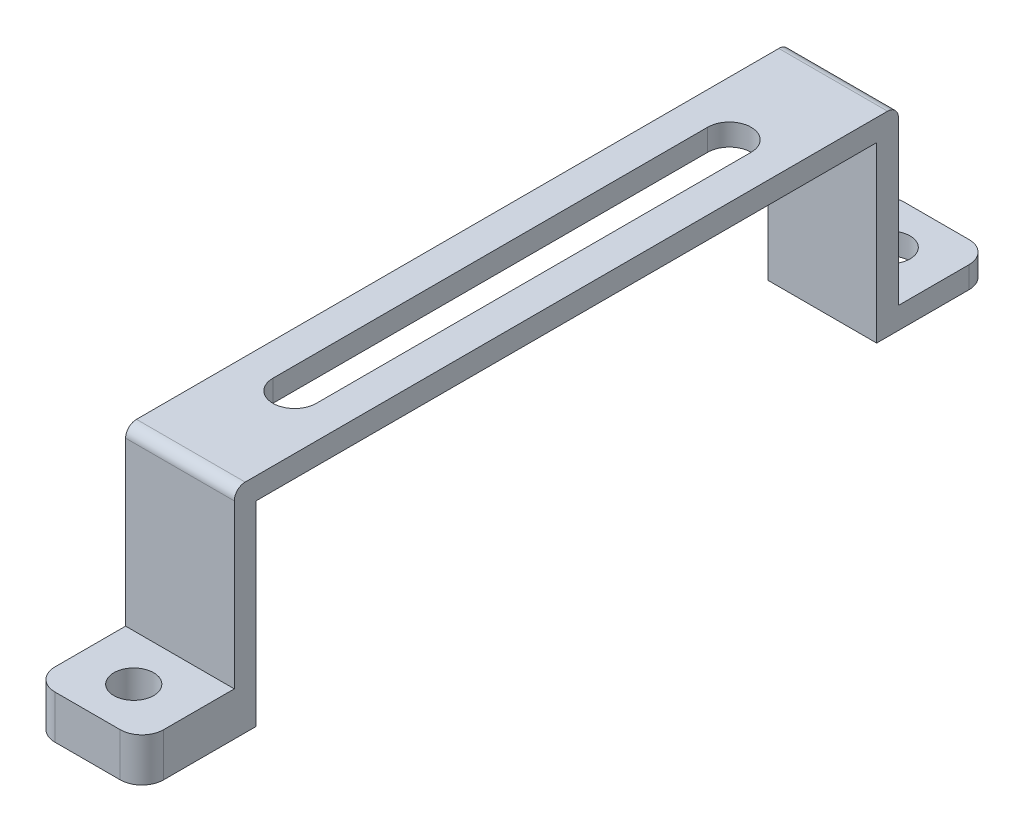
from build123d import *

# Parameters (mm, degrees)
SKETCH4_W                 = 10
SKETCH4_H                 = 57
BOSS_EXTRUDE3_DEPTH       = 2
SKETCH5_W                 = 10
SKETCH5_H                 = 2
BOSS_EXTRUDE4_DEPTH       = 2.05
SKETCH6_W                 = 10
SKETCH6_H                 = 2
BOSS_EXTRUDE5_DEPTH       = 15.9766
SKETCH7_W                 = 10
SKETCH7_H                 = 4
BOSS_EXTRUDE6_DEPTH       = 8.5
SKETCH8_W                 = 10
SKETCH8_H                 = 2
BOSS_EXTRUDE7_DEPTH       = 2.05
SKETCH9_W                 = 10
SKETCH9_H                 = 2
BOSS_EXTRUDE8_DEPTH       = 15.9766
SKETCH10_W                = 10
SKETCH10_H                = 2
BOSS_EXTRUDE9_DEPTH       = 8.5
F_6_CLEARANCE_HOLE1_D     = 3.6576
F_6_CLEARANCE_HOLE1_DEPTH = 7.62
F_6_CLEARANCE_HOLE1_TIP   = 1.0988539
FILLET2_R                 = 1
FILLET3_R                 = 2
SKETCH16_W                = 10
SKETCH16_H                = 2
BOSS_EXTRUDE10_DEPTH      = 2


with BuildPart() as part:
    # Sketch4 → Boss-Extrude3 (new body)
    with BuildSketch(Plane(origin=(0, 0, 0), x_dir=(1, 0, 0), z_dir=(0, 1, 0))):
        with Locations((11.706300269, -28.497829615)):
            Rectangle(SKETCH4_W, SKETCH4_H)
        with BuildLine():
            Line((13.706300269, -8.497829615), (13.706300269, -48.497829615))
            ThreePointArc((13.706300269, -48.497829615), (11.706300269, -50.497829615), (9.706300269, -48.497829615))
            Line((9.706300269, -48.497829615), (9.706300269, -8.497829615))
            ThreePointArc((9.706300269, -8.497829615), (11.706300269, -6.497829615), (13.706300269, -8.497829615))
        make_face(mode=Mode.SUBTRACT)
    extrude(amount=BOSS_EXTRUDE3_DEPTH)

    # Sketch5 → Boss-Extrude4 (add)
    with BuildSketch(Plane.XY.offset(56.997829615)):
        with Locations((11.706300269, 1)):
            Rectangle(SKETCH5_W, SKETCH5_H)
    extrude(amount=BOSS_EXTRUDE4_DEPTH)

    # Sketch6 → Boss-Extrude5 (add)
    with BuildSketch(Plane.XZ):
        with Locations((11.706300269, 58.047829615)):
            Rectangle(SKETCH6_W, SKETCH6_H)
    extrude(amount=BOSS_EXTRUDE5_DEPTH)

    # Sketch7 → Boss-Extrude6 (add)
    with BuildSketch(Plane.XY.offset(59.047829615)):
        with Locations((11.706300269, -15.9766)):
            Rectangle(SKETCH7_W, SKETCH7_H)
    extrude(amount=BOSS_EXTRUDE6_DEPTH)

    # Sketch8 → Boss-Extrude7 (add)
    with BuildSketch(Plane(origin=(0, 0, -0.002170385), x_dir=(-1, 0, 0), z_dir=(0, 0, -1))):
        with Locations((-11.706300269, 1)):
            Rectangle(SKETCH8_W, SKETCH8_H)
    extrude(amount=BOSS_EXTRUDE7_DEPTH)

    # Sketch9 → Boss-Extrude8 (add)
    with BuildSketch(Plane.XZ):
        with Locations((11.706300269, -1.052170385)):
            Rectangle(SKETCH9_W, SKETCH9_H)
    extrude(amount=BOSS_EXTRUDE8_DEPTH)

    # Sketch10 → Boss-Extrude9 (add)
    with BuildSketch(Plane(origin=(0, 0, -2.052170385), x_dir=(-1, 0, 0), z_dir=(0, 0, -1))):
        with Locations((-11.706300269, -14.9766)):
            Rectangle(SKETCH10_W, SKETCH10_H)
    extrude(amount=BOSS_EXTRUDE9_DEPTH)

    # #6 Clearance Hole1
    with Locations(Plane(origin=(0, -13.9766, 0), x_dir=(1, 0, 0), z_dir=(0, 1, 0))):
        with Locations((11.706300269, -63.297829615), (11.706300269, 6.302170385)):
            Hole(F_6_CLEARANCE_HOLE1_D / 2, depth=F_6_CLEARANCE_HOLE1_DEPTH)
            with Locations((0, 0, -(F_6_CLEARANCE_HOLE1_DEPTH + F_6_CLEARANCE_HOLE1_TIP / 2))):  # 118° drill point
                Cone(0, F_6_CLEARANCE_HOLE1_D / 2, F_6_CLEARANCE_HOLE1_TIP, mode=Mode.SUBTRACT)

    # Fillet2
    fillet2_edges = [part.edges().sort_by_distance(p)[0] for p in [
        (11.706300269, 2, 59.047829615),
        (11.706300269, 2, -2.052170385),
    ]]
    fillet(fillet2_edges, radius=FILLET2_R)

    # Fillet3
    fillet3_edges = [part.edges().sort_by_distance(p)[0] for p in [
        (16.706300269, -15.9766, 67.547829615),
        (6.706300269, -15.9766, 67.547829615),
        (16.706300269, -14.9766, -10.552170385),
        (6.706300269, -14.9766, -10.552170385),
    ]]
    fillet(fillet3_edges, radius=FILLET3_R)

    # Sketch16 → Boss-Extrude10 (add)
    with BuildSketch(Plane(origin=(0, 0, 59.047829615), x_dir=(-1, 0, 0), z_dir=(0, 0, -1))):
        with Locations((-11.706300269, -16.9766)):
            Rectangle(SKETCH16_W, SKETCH16_H)
    extrude(amount=BOSS_EXTRUDE10_DEPTH)


solid = part.part
